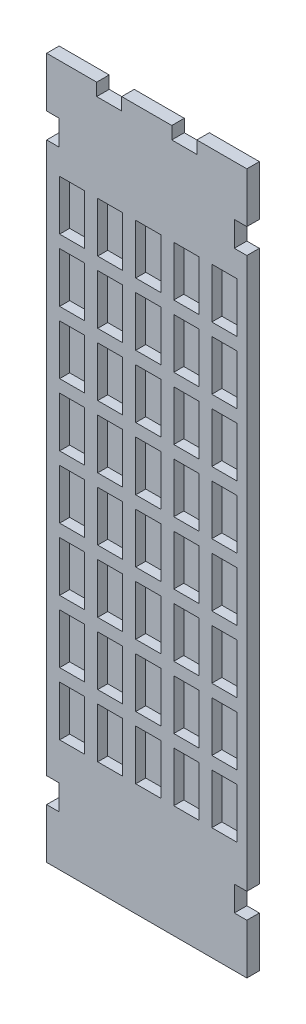
from build123d import *

# Parameters (mm, degrees)
BOSS_EXTRUDE1_DEPTH  = 3.175
SKETCH2_W            = 6.35
SKETCH2_H            = 12.7
CUT_EXTRUDE1_DEPTH   = 2.54
LPATTERN1_COUNT      = 5
LPATTERN1_PITCH      = 9.652
LPATTERN1_COUNT_DIR2 = 8
LPATTERN1_PITCH_DIR2 = 15.875


with BuildPart() as part:
    # Sketch1 → Boss-Extrude1 (new body)
    with BuildSketch(Plane.XY):
        Polygon((0, -177.8), (12.7, -177.8), (38.1, -177.8), (50.8, -177.8), (50.8, -165.1), (47.625, -165.1), (47.625, -158.75), (50.8, -158.75), (50.8, -19.05), (47.625, -19.05), (47.625, -12.7), (50.8, -12.7), (50.8, 0), (38.1, 0), (38.1, -3.175), (31.75, -3.175), (31.75, 0), (19.05, 0), (19.05, -3.175), (12.7, -3.175), (12.7, 0), (0, 0), (0, -12.7), (3.175, -12.7), (3.175, -19.05), (0, -19.05), (0, -158.75), (3.175, -158.75), (3.175, -165.1), (0, -165.1), align=None)
    extrude(amount=BOSS_EXTRUDE1_DEPTH)

    # Sketch2 → Cut-Extrude1 (cut)
    with BuildSketch(Plane.XY.offset(3.175)):
        with Locations((6.477, -31.75)):
            Rectangle(SKETCH2_W, SKETCH2_H)
    cut_extrude1 = extrude(amount=-CUT_EXTRUDE1_DEPTH, mode=Mode.SUBTRACT)

    # LPattern1: Cut-Extrude1 5 × 8
    with Locations(*[(i * LPATTERN1_PITCH, -j * LPATTERN1_PITCH_DIR2, 0) for i in range(LPATTERN1_COUNT) for j in range(LPATTERN1_COUNT_DIR2) if (i, j) != (0, 0)]):
        add(cut_extrude1, mode=Mode.SUBTRACT)


solid = part.part
